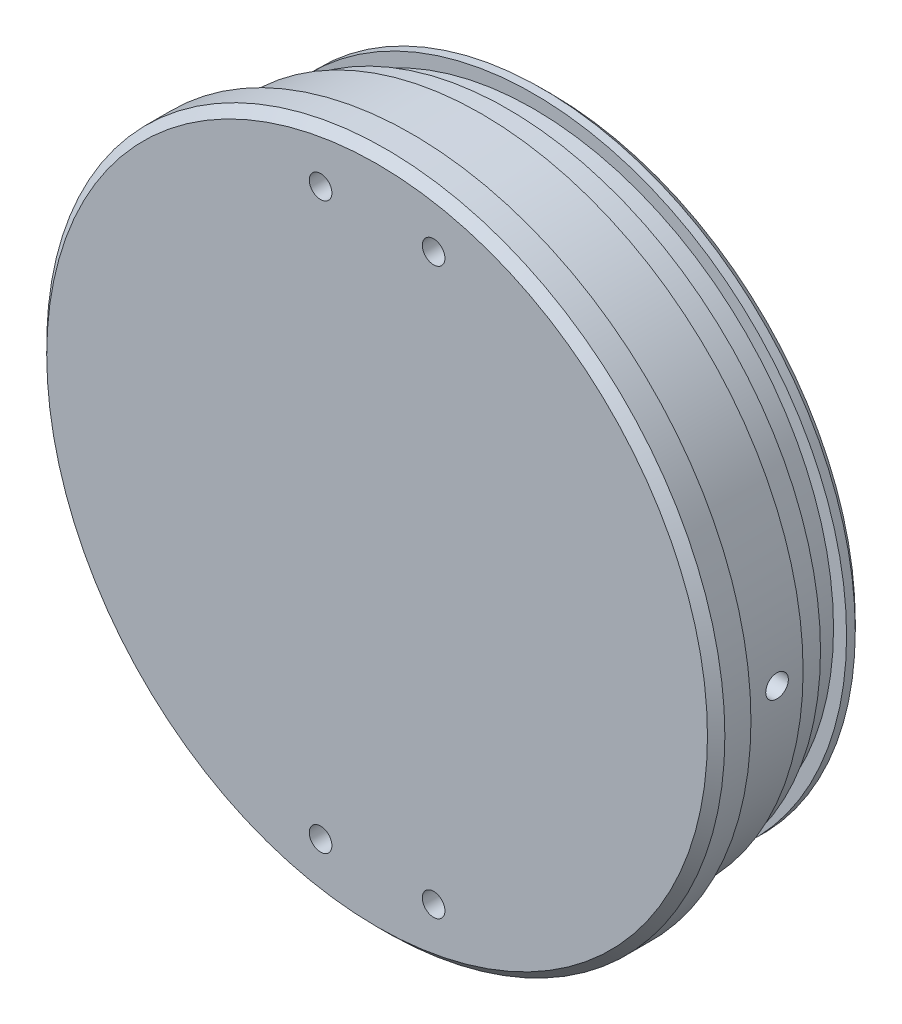
from build123d import *

# Parameters (mm, degrees)
SKETCH_1_R          = 39
EXTRUDE_1_DEPTH     = 4
SKETCH_3_R          = 37
EXTRUDE_2_DEPTH     = 8
SKETCH_4_R          = 36
EXTRUDE_3_DEPTH     = 8
SKETCH_5_W          = 3
SKETCH_5_H          = 1.5
SKETCH_7_R          = 27
CUT_EXTRUDE_1_DEPTH = 17
CHAMFER_2_SIZE      = 1
SKETCH_14_R         = 1.3
CUT_EXTRUDE_4_DEPTH = 7
CUT_EXTRUDE_START   = 7
SKETCH_16_R         = 1.3
CUT_EXTRUDE_5_DEPTH = 7
SKETCH_18_R         = 1.3
CUT_EXTRUDE_6_DEPTH = 7
CHAMFER_3_SIZE      = 1


with BuildPart() as part:
    # Sketch 1 → Бобышка-Вытянуть1 (new body)
    with BuildSketch(Plane.XY):
        Circle(SKETCH_1_R)
    extrude(amount=EXTRUDE_1_DEPTH)

    # Эскиз3 → Бобышка-Вытянуть2 (add)
    with BuildSketch(Plane(origin=(0, 0, 0), x_dir=(-1, 0, 0), z_dir=(0, 0, -1))):
        with Locations(Location((0, 0, 0), (0, 0, 180))):
            Circle(SKETCH_3_R)
    extrude(amount=EXTRUDE_2_DEPTH)

    # Эскиз4 → Бобышка-Вытянуть3 (add)
    with BuildSketch(Plane(origin=(0, 0, -8), x_dir=(-1, 0, 0), z_dir=(0, 0, -1))):
        Circle(SKETCH_4_R)
    extrude(amount=EXTRUDE_3_DEPTH)

    # Эскиз5 → Вырез-Повернуть1 (revolve, cut)
    with BuildSketch(Plane(origin=(0, 0, 0), x_dir=(0, 0, -1), z_dir=(1, 0, 0)), mode=Mode.PRIVATE) as cut_revolve_1_sk:
        with Locations((12.5, 35.25)):
            Rectangle(SKETCH_5_W, SKETCH_5_H)
    revolve(cut_revolve_1_sk.sketch.rotate(Axis((0, 0, 46.650977883), (0, 0, -1)), 90), axis=Axis((0, 0, 46.650977883), (0, 0, -1)), mode=Mode.SUBTRACT)

    # Эскиз7 → Вырез-Вытянуть1 (cut)
    with BuildSketch(Plane(origin=(0, 0, -16), x_dir=(-1, 0, 0), z_dir=(0, 0, -1))):
        Circle(SKETCH_7_R)
    extrude(amount=-CUT_EXTRUDE_1_DEPTH, mode=Mode.SUBTRACT)

    # Фаска2
    chamfer_2_edges = [part.edges().sort_by_distance(p)[0] for p in [
        (36, 0, -16),
    ]]
    chamfer(chamfer_2_edges, length=CHAMFER_2_SIZE)

    # Эскиз14 → Вырез-Вытянуть4 (cut)
    with BuildSketch(Plane(origin=(37, 0, 0), x_dir=(0, 0, -1), z_dir=(1, 0, 0))):
        with Locations((5, 0)):
            Circle(SKETCH_14_R)
    extrude(amount=-CUT_EXTRUDE_4_DEPTH, mode=Mode.SUBTRACT)

    # Эскиз16 → Вырез-Вытянуть5 (cut)
    with BuildSketch(Plane(origin=(-37, 0, 0), x_dir=(0, 0, -1), z_dir=(1, 0, 0)).offset(CUT_EXTRUDE_START)):
        with Locations((5, 0)):
            Circle(SKETCH_16_R)
    extrude(amount=-CUT_EXTRUDE_5_DEPTH, mode=Mode.SUBTRACT)

    # Эскиз18 → Вырез-Вытянуть6 (cut)
    with BuildSketch(Plane.XY.offset(4)):
        with Locations((6.5, 32.5)):
            Circle(SKETCH_18_R)
        with Locations(Location((-6.5, 32.5, 0), (0, 0, 180))):
            Circle(SKETCH_18_R)
        with Locations(Location((6.5, -32.5, 0), (0, 0, 180))):
            Circle(SKETCH_18_R)
        with Locations((-6.5, -32.5)):
            Circle(SKETCH_18_R)
    extrude(amount=-CUT_EXTRUDE_6_DEPTH, mode=Mode.SUBTRACT)

    # Фаска3
    chamfer_3_edges = [part.edges().sort_by_distance(p)[0] for p in [
        (27, 0, 1),
        (27, 0, -16),
        (-39, 0, 4),
    ]]
    chamfer(chamfer_3_edges, length=CHAMFER_3_SIZE)


solid = part.part
